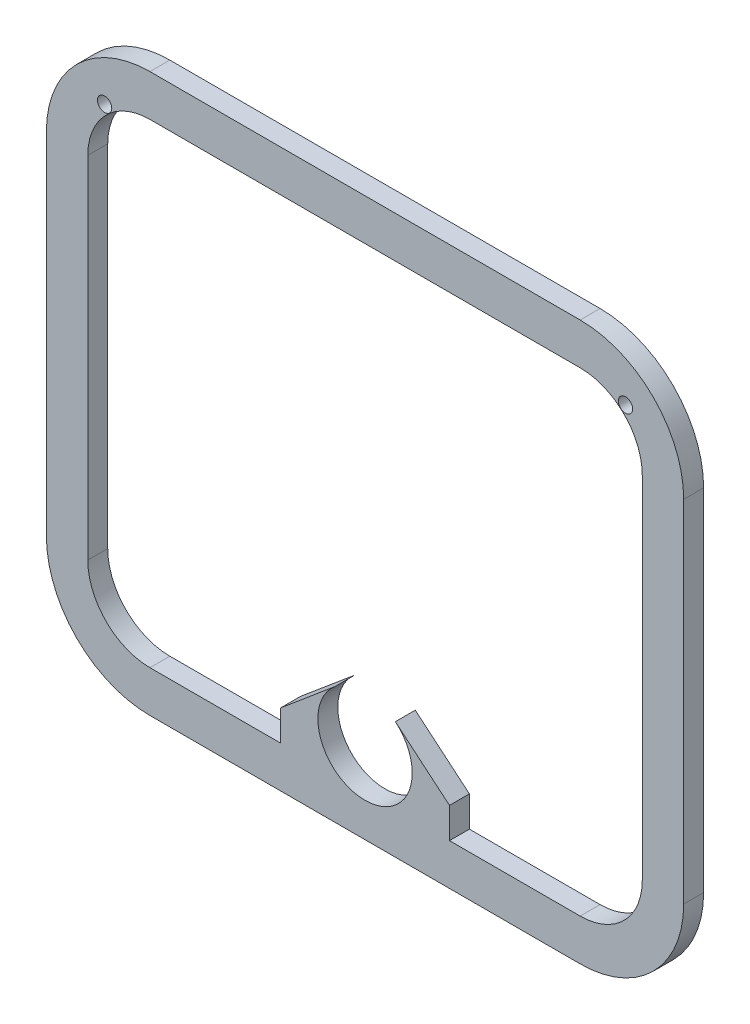
from build123d import *

# Parameters (mm, degrees)
SKETCH1_R           = 0.5715
BOSS_EXTRUDE1_DEPTH = 1.5875
CUT_EXTRUDE1_REACH  = 35.788
SKETCH2_W           = 2.901094666
SKETCH2_H           = 2.434307465


with BuildPart() as part:
    # Sketch1 → Boss-Extrude1 (new body)
    with BuildSketch(Plane.XY):
        with BuildLine():
            Line((17.145, 22.225), (-17.145, 22.225))
            ThreePointArc((-17.145, 22.225), (-22.982166479, 19.807166479), (-25.4, 13.97))
            Line((-25.4, 13.97), (-25.4, -13.97))
            ThreePointArc((-25.4, -13.97), (-22.982166479, -19.807166479), (-17.145, -22.225))
            Line((-17.145, -22.225), (17.145, -22.225))
            ThreePointArc((17.145, -22.225), (22.982166479, -19.807166479), (25.4, -13.97))
            Line((25.4, -13.97), (25.4, 13.97))
            ThreePointArc((25.4, 13.97), (22.982166479, 19.807166479), (17.145, 22.225))
        make_face()
        with Locations((-20.759611123, 18.164659732)):
            Circle(SKETCH1_R, mode=Mode.SUBTRACT)
        with Locations(Location((20.759611123, 18.164659732, 0), (0, 0, 180))):
            Circle(SKETCH1_R, mode=Mode.SUBTRACT)
        with BuildLine():
            Line((-17.145, -18.923), (-9.632094666, -18.923))
            Line((-9.632094666, -18.923), (-2.416367182, -12.868285729))
            ThreePointArc((-2.416367182, -12.868285729), (0, -19.5072), (2.416367182, -12.868285729))
            Line((2.416367182, -12.868285729), (9.632094666, -18.923))
            Line((9.632094666, -18.923), (17.145, -18.923))
            ThreePointArc((17.145, -18.923), (20.647299887, -17.472299887), (22.098, -13.97))
            Line((22.098, -13.97), (22.098, 13.97))
            ThreePointArc((22.098, 13.97), (20.647299887, 17.472299887), (17.145, 18.923))
            Line((17.145, 18.923), (-17.145, 18.923))
            ThreePointArc((-17.145, 18.923), (-20.647299887, 17.472299887), (-22.098, 13.97))
            Line((-22.098, 13.97), (-22.098, -13.97))
            ThreePointArc((-22.098, -13.97), (-20.647299887, -17.472299887), (-17.145, -18.923))
        make_face(mode=Mode.SUBTRACT)
    extrude(amount=BOSS_EXTRUDE1_DEPTH)

    # Sketch2 → Cut-Extrude1 (cut, up to next)
    with BuildSketch(Plane.XY.offset(1.5875), mode=Mode.PRIVATE) as cut_extrude1_sk1:
        with Locations((-8.181547333, -17.705846268)):
            Rectangle(SKETCH2_W, SKETCH2_H)
    cut_extrude1_tool1 = extrude(cut_extrude1_sk1.sketch, amount=-CUT_EXTRUDE1_REACH, mode=Mode.PRIVATE) & part.part
    # Sketch2 → Cut-Extrude1 (cut, up to next)
    with BuildSketch(Plane.XY.offset(1.5875), mode=Mode.PRIVATE) as cut_extrude1_sk2:
        with Locations((8.181547333, -17.705846268)):
            Rectangle(SKETCH2_W, SKETCH2_H)
    cut_extrude1_tool2 = extrude(cut_extrude1_sk2.sketch, amount=-CUT_EXTRUDE1_REACH, mode=Mode.PRIVATE) & part.part
    add(cut_extrude1_tool1.solids().sort_by_distance((-8.181547, -17.705846, 1.5875))[0], mode=Mode.SUBTRACT)
    add(cut_extrude1_tool2.solids().sort_by_distance((8.181547, -17.705846, 1.5875))[0], mode=Mode.SUBTRACT)


solid = part.part
